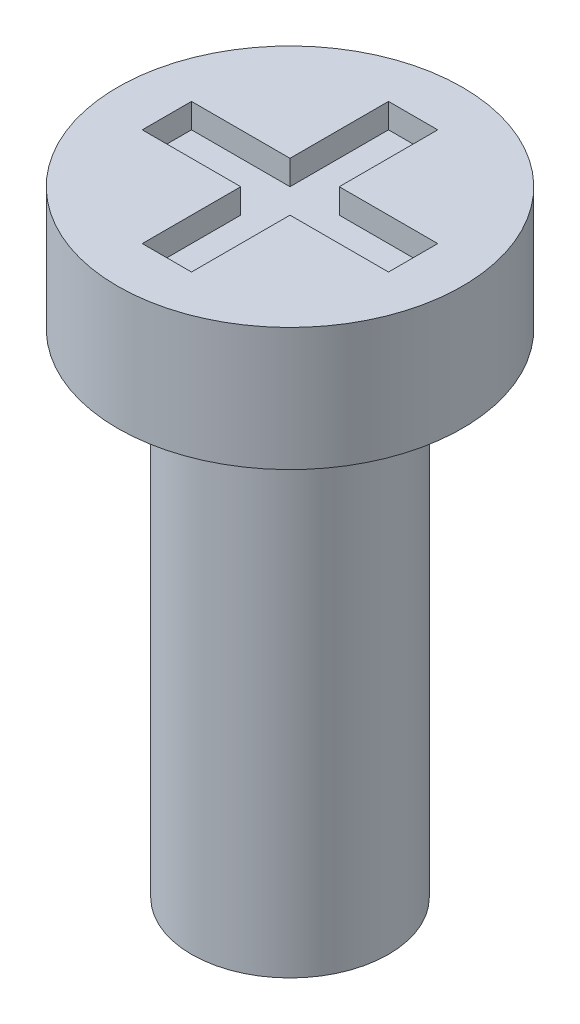
from build123d import *

# Parameters (mm, degrees)
SKETCH1_R           = 0.4
BOSS_EXTRUDE1_DEPTH = 2
SKETCH2_R           = 0.7
BOSS_EXTRUDE2_DEPTH = 0.5
CUT_EXTRUDE1_DEPTH  = 0.1


with BuildPart() as part:
    # Sketch1 → Boss-Extrude1 (new body)
    with BuildSketch(Plane(origin=(0, 0, 0), x_dir=(1, 0, 0), z_dir=(0, 1, 0))):
        with Locations(Location((0, 0, 0), (0, 0, 270))):
            Circle(SKETCH1_R)
    extrude(amount=BOSS_EXTRUDE1_DEPTH)

    # Sketch2 → Boss-Extrude2 (add)
    with BuildSketch(Plane(origin=(0, 2, 0), x_dir=(1, 0, 0), z_dir=(0, 1, 0))):
        with Locations(Location((0, 0, 0), (0, 0, 270))):
            Circle(SKETCH2_R)
    extrude(amount=BOSS_EXTRUDE2_DEPTH)

    # Sketch3 → Cut-Extrude1 (cut)
    with BuildSketch(Plane(origin=(0, 2.5, 0), x_dir=(1, 0, 0), z_dir=(0, 1, 0))):
        Polygon((-0.1, -0.1), (-0.1, -0.5), (0.1, -0.5), (0.1, -0.1), (0.5, -0.1), (0.5, 0.1), (0.1, 0.1), (0.1, 0.5), (-0.1, 0.5), (-0.1, 0.1), (-0.5, 0.1), (-0.5, -0.1), align=None)
    extrude(amount=-CUT_EXTRUDE1_DEPTH, mode=Mode.SUBTRACT)


solid = part.part
